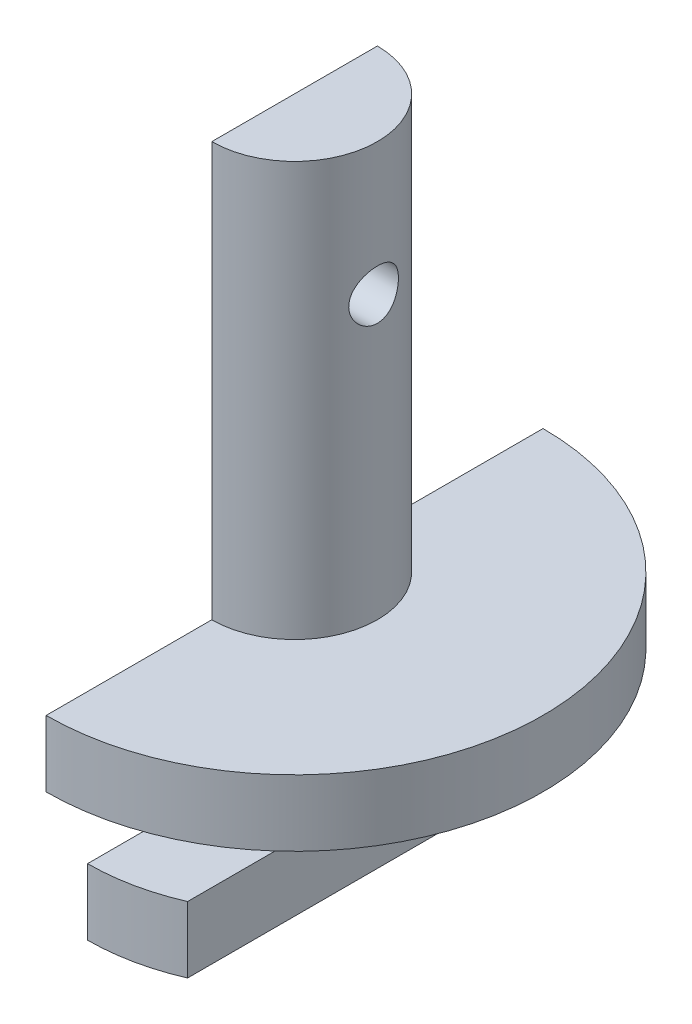
from build123d import *

# Parameters (mm, degrees)
CUT_EXTRUDE1_DEPTH      = 44.520110294
CUT_EXTRUDE1_DEPTH_BACK = 44.520110294
SKETCH2_W               = 21.666012185
SKETCH2_H               = 9.766463862
CUT_EXTRUDE2_DEPTH      = 44.520110294
CUT_EXTRUDE2_DEPTH_BACK = 44.520110294
SKETCH3_R               = 1.5
CUT_EXTRUDE3_DEPTH      = 44.520110381
CUT_EXTRUDE3_DEPTH_BACK = 44.520110381
SKETCH4_W               = 24.279573728
SKETCH4_H               = 56.824995672


with BuildPart() as part:
    # Sketch1 → Revolve1 (revolve)
    with BuildSketch(Plane.XY, mode=Mode.PRIVATE) as revolve1_sk:
        Polygon((0, 0), (0, 38), (5, 38), (5, 13), (15, 13), (15, 9), (7.5, 9), (7.5, 4), (12.5, 4), (12.5, 0), align=None)
    revolve(revolve1_sk.sketch.rotate(Axis((0, 0, 0), (0, 1, 0)), 90), axis=Axis((0, 0, 0), (0, 1, 0)))

    # Sketch2 → Cut-Extrude1 (cut, two sides: drawn at the far end of the back side and taken through both)
    with BuildSketch(Plane.XY.offset(-CUT_EXTRUDE1_DEPTH_BACK)):
        with Locations((15.833006093, -0.883231931)):
            Rectangle(SKETCH2_W, SKETCH2_H)
    extrude(amount=CUT_EXTRUDE1_DEPTH + CUT_EXTRUDE1_DEPTH_BACK, mode=Mode.SUBTRACT)

    # Sketch3 → Cut-Extrude2 (cut, two sides: drawn at the far end of the back side and taken through both)
    with BuildSketch(Plane(origin=(0, 0, 0), x_dir=(0, 0, -1), z_dir=(1, 0, 0)).offset(-CUT_EXTRUDE2_DEPTH_BACK)):
        with Locations((0, 30)):
            Circle(SKETCH3_R)
    extrude(amount=CUT_EXTRUDE2_DEPTH + CUT_EXTRUDE2_DEPTH_BACK, mode=Mode.SUBTRACT)

    # Sketch4 → Cut-Extrude3 (cut, two sides: drawn at the far end of the back side and taken through both)
    with BuildSketch(Plane.XY.offset(-CUT_EXTRUDE3_DEPTH_BACK)):
        with Locations((-12.139786864, 22.787379867)):
            Rectangle(SKETCH4_W, SKETCH4_H)
    extrude(amount=CUT_EXTRUDE3_DEPTH + CUT_EXTRUDE3_DEPTH_BACK, mode=Mode.SUBTRACT)


solid = part.part
